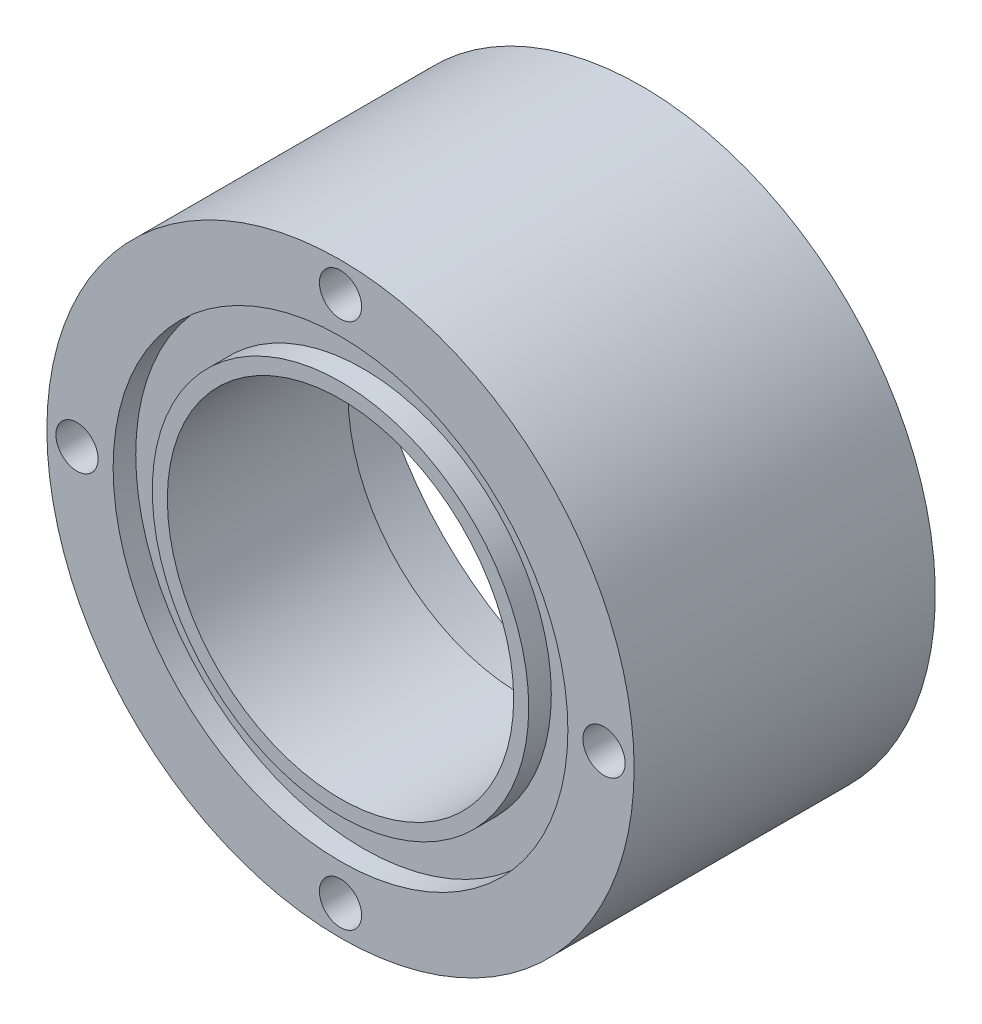
from build123d import *

# Parameters (mm, degrees)
SKETCH1_R           = 19.5
SKETCH1_R_2         = 11.5
EXTRUDE_THIN1_DEPTH = 12
SKETCH2_R           = 1.4
CUT_EXTRUDE1_DEPTH  = 7
CIRPATTERN1_COUNT   = 4
SKETCH5_R           = 15.1
SKETCH5_R_2         = 12.5
CUT_EXTRUDE3_DEPTH  = 1.5
SKETCH6_R           = 1.4
CUT_EXTRUDE4_DEPTH  = 7
CUT_EXTRUDE5_START  = -1.5
SKETCH7_R           = 15.1
SKETCH7_R_2         = 12.5
CUT_EXTRUDE5_DEPTH  = 1.5
EXTRUDE_THIN3_START = 8
SKETCH9_R           = 19.5
SKETCH9_R_2         = 18.5
EXTRUDE_THIN3_DEPTH = 8


with BuildPart() as part:
    # Sketch1 → Extrude-Thin1 (new body)
    with BuildSketch(Plane.XY):
        Circle(SKETCH1_R)
        Circle(SKETCH1_R_2, mode=Mode.SUBTRACT)
    extrude(amount=EXTRUDE_THIN1_DEPTH)

    # Sketch2 → Cut-Extrude1 (cut)
    with BuildSketch(Plane.XY.offset(12)):
        with Locations((0, 17.5)):
            Circle(SKETCH2_R)
    cut_extrude1 = extrude(amount=-CUT_EXTRUDE1_DEPTH, mode=Mode.SUBTRACT)

    # CirPattern1: Cut-Extrude1 ×4 about axis
    cirpattern1_axis = Axis((0, 0, 0), (0, 0, 1))
    for i in range(1, CIRPATTERN1_COUNT):
        add(cut_extrude1.rotate(cirpattern1_axis, i * 360 / CIRPATTERN1_COUNT), mode=Mode.SUBTRACT)

    # Sketch5 → Cut-Extrude3 (cut)
    with BuildSketch(Plane.XY.offset(12)):
        Circle(SKETCH5_R)
        Circle(SKETCH5_R_2, mode=Mode.SUBTRACT)
    extrude(amount=-CUT_EXTRUDE3_DEPTH, mode=Mode.SUBTRACT)

    # Sketch6 → Cut-Extrude4 (cut)
    with BuildSketch(Plane(origin=(0, 0, 0), x_dir=(-1, 0, 0), z_dir=(0, 0, -1))):
        with Locations((0, -17)):
            Circle(SKETCH6_R)
        with Locations((-17, 0)):
            Circle(SKETCH6_R)
        with Locations((0, 17)):
            Circle(SKETCH6_R)
        with Locations((17, 0)):
            Circle(SKETCH6_R)
    extrude(amount=-CUT_EXTRUDE4_DEPTH, mode=Mode.SUBTRACT)

    # Sketch7 → Cut-Extrude5 (cut)
    with BuildSketch(Plane(origin=(0, 0, 0), x_dir=(-1, 0, 0), z_dir=(0, 0, -1)).offset(CUT_EXTRUDE5_START)):
        with Locations(Location((0, 0, 0), (0, 0, 180))):
            Circle(SKETCH7_R)
        with Locations(Location((0, 0, 0), (0, 0, 180))):
            Circle(SKETCH7_R_2, mode=Mode.SUBTRACT)
    extrude(amount=CUT_EXTRUDE5_DEPTH, mode=Mode.SUBTRACT)

    # Sketch9 → Extrude-Thin3 (add)
    with BuildSketch(Plane(origin=(0, 0, 0), x_dir=(-1, 0, 0), z_dir=(0, 0, -1)).offset(EXTRUDE_THIN3_START)):
        Circle(SKETCH9_R)
        Circle(SKETCH9_R_2, mode=Mode.SUBTRACT)
    extrude(amount=-EXTRUDE_THIN3_DEPTH)


solid = part.part
